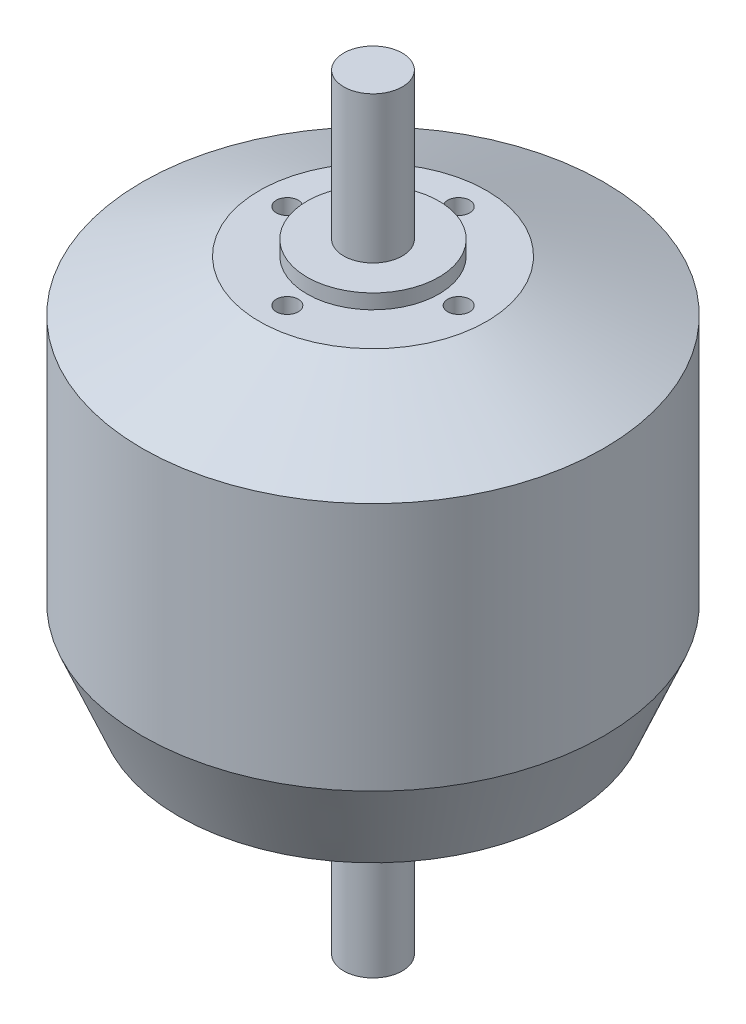
from build123d import *

# Parameters (mm, degrees)
SKETCH1_R           = 31.5
BOSS_EXTRUDE1_DEPTH = 55
CUT_EXTRUDE1_START  = 53
SKETCH1_4_R         = 31.5
SKETCH1_4_R_2       = 9
CUT_EXTRUDE1_DEPTH  = 2
SKETCH1_5_R         = 4
BOSS_EXTRUDE2_DEPTH = 29.525
SKETCH1_7_R         = 2
CUT_EXTRUDE2_DEPTH  = 10
CUT_EXTRUDE3_START  = 53
SKETCH1_10_R        = 1.5
CUT_EXTRUDE3_DEPTH  = 5
CHAMFER1_SIZE       = 5
CHAMFER1_SIZE2      = 12
CHAMFER2_SIZE       = 7
CHAMFER2_SIZE2      = 16
BOSS_EXTRUDE4_START = 75
SKETCH1_11_R        = 4
BOSS_EXTRUDE4_DEPTH = 20


with BuildPart() as part:
    # Sketch1 → Boss-Extrude1 (new body)
    with BuildSketch(Plane(origin=(0, 0, 0), x_dir=(1, 0, 0), z_dir=(0, 1, 0))):
        with Locations(Location((0, 0, 0), (0, 0, 270))):
            Circle(SKETCH1_R)
    extrude(amount=BOSS_EXTRUDE1_DEPTH)

    # Sketch1<4> → Cut-Extrude1 (cut)
    with BuildSketch(Plane(origin=(0, 0, 0), x_dir=(1, 0, 0), z_dir=(0, 1, 0)).offset(CUT_EXTRUDE1_START)):
        with Locations(Location((0, 0, 0), (0, 0, 270))):
            Circle(SKETCH1_4_R)
        with Locations(Location((0, 0, 0), (0, 0, 270))):
            Circle(SKETCH1_4_R_2, mode=Mode.SUBTRACT)
    extrude(amount=CUT_EXTRUDE1_DEPTH, mode=Mode.SUBTRACT)

    # Sketch1<5> → Boss-Extrude2 (add)
    with BuildSketch(Plane(origin=(0, 0, 0), x_dir=(1, 0, 0), z_dir=(0, 1, 0))):
        with Locations(Location((0, 0, 0), (0, 0, 270))):
            Circle(SKETCH1_5_R)
    extrude(amount=-BOSS_EXTRUDE2_DEPTH)

    # Sketch1<7> → Cut-Extrude2 (cut)
    with BuildSketch(Plane(origin=(0, 0, 0), x_dir=(1, 0, 0), z_dir=(0, 1, 0))):
        with Locations(Location((22.2, 0, 0), (0, 0, 270))):
            Circle(SKETCH1_7_R)
        with Locations(Location((0, 22.2, 0), (0, 0, 270))):
            Circle(SKETCH1_7_R)
        with Locations(Location((-22.2, 0, 0), (0, 0, 270))):
            Circle(SKETCH1_7_R)
        with Locations(Location((0, -22.2, 0), (0, 0, 270))):
            Circle(SKETCH1_7_R)
    extrude(amount=CUT_EXTRUDE2_DEPTH, mode=Mode.SUBTRACT)

    # Sketch1<10> → Cut-Extrude3 (cut)
    with BuildSketch(Plane(origin=(0, 0, 0), x_dir=(1, 0, 0), z_dir=(0, 1, 0)).offset(CUT_EXTRUDE3_START)):
        with Locations(Location((-11.7, 0, 0), (0, 0, 270))):
            Circle(SKETCH1_10_R)
        with Locations(Location((0, 11.7, 0), (0, 0, 270))):
            Circle(SKETCH1_10_R)
        with BuildLine():
            ThreePointArc((13.2, 0), (11.7, 1.5), (10.2, 0))
            Line((10.2, 0), (13.2, 0))
        make_face()
        with BuildLine():
            Line((13.2, 0), (10.2, 0))
            ThreePointArc((10.2, 0), (11.7, -1.5), (13.2, 0))
        make_face()
        with Locations(Location((0, -11.7, 0), (0, 0, 270))):
            Circle(SKETCH1_10_R)
    extrude(amount=-CUT_EXTRUDE3_DEPTH, mode=Mode.SUBTRACT)

    # Chamfer1
    chamfer1_edges = [part.edges().sort_by_distance(p)[0] for p in [
        (0, 0, -31.5),
    ]]
    chamfer1_side = [part.faces().sort_by_distance(p)[0] for p in [
        (0, 0, -30.609045456),
    ]]
    chamfer(chamfer1_edges, length=CHAMFER1_SIZE, length2=CHAMFER1_SIZE2, reference=chamfer1_side[0])

    # Chamfer2
    chamfer2_edges = [part.edges().sort_by_distance(p)[0] for p in [
        (0, 53, -31.5),
    ]]
    chamfer2_side = [part.faces().sort_by_distance(p)[0] for p in [
        (0, 32.5, -31.5),
    ]]
    chamfer(chamfer2_edges, length=CHAMFER2_SIZE, length2=CHAMFER2_SIZE2, reference=chamfer2_side[0])

    # Sketch1<11> → Boss-Extrude4 (add)
    with BuildSketch(Plane(origin=(0, 0, 0), x_dir=(1, 0, 0), z_dir=(0, 1, 0)).offset(BOSS_EXTRUDE4_START)):
        with Locations(Location((0, 0, 0), (0, 0, 270))):
            Circle(SKETCH1_11_R)
    extrude(amount=-BOSS_EXTRUDE4_DEPTH)


solid = part.part
